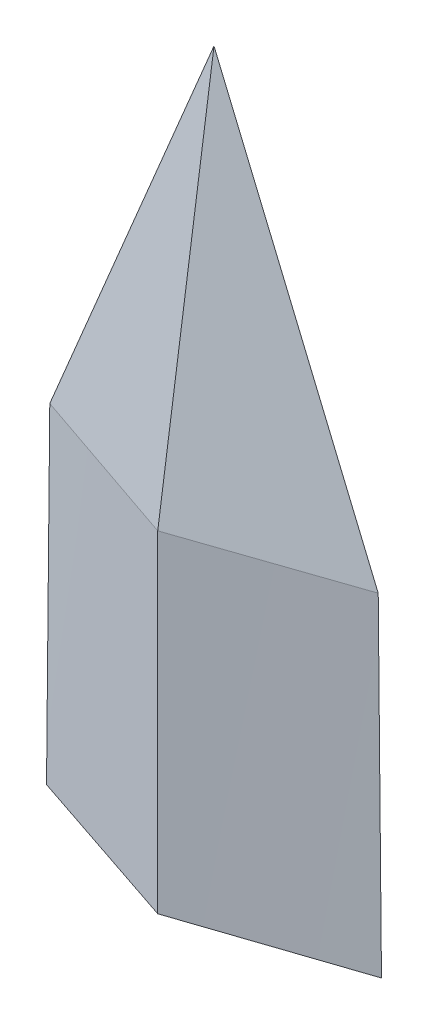
from build123d import *

# Parameters (mm, degrees)
BOSS_EXTRUDE1_DEPTH      = 11.1125
BOSS_EXTRUDE1_DEPTH_BACK = 11.1125
SKETCH5_W                = 109.877468776
SKETCH5_H                = 283.051122129
CUT_EXTRUDE2_DEPTH       = 1193.492852366
SKETCH6_W                = 149.121482991
SKETCH6_H                = 108.921761737
CUT_EXTRUDE3_DEPTH       = 1175.662940665
SKETCH7_R                = 4.7625
CUT_EXTRUDE4_DEPTH       = 635
CUT_EXTRUDE8_DEPTH       = 1195.766301895
CUT_EXTRUDE8_DEPTH_BACK  = 1195.766301895
SKETCH8_W                = 149.774750394
SKETCH8_H                = 148.832770831
SKETCH8_H_2              = 142.875
SKETCH17_R               = 1.5875
CUT_EXTRUDE15_DEPTH      = 12.7


with BuildPart() as part:
    # Sketch1 → Boss-Extrude1 (new, two sides: drawn at the far end of the back side and taken through both)
    with BuildSketch(Plane.XY.offset(-BOSS_EXTRUDE1_DEPTH_BACK)):
        Polygon((142.42123069, 465.168027231), (219.716026672, 465.168027231), (213.502471629, 1096.967634552), (181.068628681, 1174.337215652), (148.634785732, 1096.967634552), align=None)
    extrude(amount=BOSS_EXTRUDE1_DEPTH + BOSS_EXTRUDE1_DEPTH_BACK)

    # Sketch2 → Cut-Loft1 section 0
    with BuildSketch(Plane.XZ.offset(-465.168027231)):
        with BuildLine():
            Line((142.42123069, 0), (181.068628681, 11.1125))
            Line((181.068628681, 11.1125), (219.716026672, 0))
            Line((219.716026672, 0), (222.70513775, 0))
            Line((222.70513775, 0), (222.70513775, 15.258366339))
            Line((222.70513775, 15.258366339), (137.848628215, 15.258366339))
            Line((137.848628215, 15.258366339), (137.848628215, 0))
            Line((137.848628215, 0), (142.42123069, 0))
        make_face()
    # Sketch3 → Cut-Loft1 section 1
    with BuildSketch(Plane(origin=(0, 1096.967634552, 0), x_dir=(1, 0, 0), z_dir=(0, 1, 0))):
        with BuildLine():
            Line((213.502471629, 0), (181.068628681, -11.1125))
            Line((181.068628681, -11.1125), (148.634785732, 0))
            Line((148.634785732, 0), (137.848628215, 0))
            Line((137.848628215, 0), (137.848628215, -15.258366339))
            Line((137.848628215, -15.258366339), (222.70513775, -15.258366339))
            Line((222.70513775, -15.258366339), (222.70513775, 0))
            Line((222.70513775, 0), (213.502471629, 0))
        make_face()
    cut_loft1 = loft(mode=Mode.SUBTRACT)

    # Mirror1: Cut-Loft1 across plane
    add(cut_loft1.mirror(Plane.XY), mode=Mode.SUBTRACT)

    # Sketch5 → Cut-Extrude2 (cut, through all)
    with BuildSketch(Plane(origin=(-32.103098407, 13.457832356, 93.698704331), x_dir=(0.9470206004067627, 0.045661094409327196, 0.31791043842968925), z_dir=(-0.3211728232668741, 0.1346377834927197, 0.937401026696127))):
        with Locations((219.349244299, 1139.303724701)):
            Rectangle(SKETCH5_W, SKETCH5_H)
    cut_extrude2 = extrude(amount=CUT_EXTRUDE2_DEPTH, mode=Mode.SUBTRACT)

    # Sketch6 → Cut-Extrude3 (cut, through all)
    with BuildSketch(Plane(origin=(69.458274406, 29.117370568, 202.726547902), x_dir=(0.9470206004067623, -0.045661094409327495, -0.31791043842969063), z_dir=(0.3211728232668754, 0.13463778349272, 0.9374010266961263))):
        with Locations((131.752816965, 1118.922251835)):
            Rectangle(SKETCH6_W, SKETCH6_H)
    cut_extrude3 = extrude(amount=CUT_EXTRUDE3_DEPTH, mode=Mode.SUBTRACT)

    # Mirror2: Cut-Extrude2, Cut-Extrude3 across plane
    add(cut_extrude2.mirror(Plane.XY), mode=Mode.SUBTRACT)
    add(cut_extrude3.mirror(Plane.XY), mode=Mode.SUBTRACT)

    # Sketch7 → Cut-Extrude4 (cut)
    with BuildSketch(Plane.XZ.offset(-465.168027231)):
        with Locations(Location((181.068628681, 0, 0), (0, 0, 270))):
            Circle(SKETCH7_R)
    extrude(amount=-CUT_EXTRUDE4_DEPTH, mode=Mode.SUBTRACT)

    # Sketch8 → Cut-Extrude8 (cut, two sides: drawn at the far end of the back side and taken through both)
    with BuildSketch(Plane.XY.offset(-CUT_EXTRUDE8_DEPTH_BACK)):
        with Locations((180.5976389, 528.420830237)):
            Rectangle(SKETCH8_W, SKETCH8_H)
        with Locations((180.5976389, 674.274715652)):
            Rectangle(SKETCH8_W, SKETCH8_H_2)
        with Locations((180.5976389, 817.149715652)):
            Rectangle(SKETCH8_W, SKETCH8_H_2)
        with Locations((180.5976389, 960.024715652)):
            Rectangle(SKETCH8_W, SKETCH8_H_2)
    extrude(amount=CUT_EXTRUDE8_DEPTH + CUT_EXTRUDE8_DEPTH_BACK, mode=Mode.SUBTRACT)

    # Sketch17 → Cut-Extrude15 (cut)
    with BuildSketch(Plane.XZ.offset(-1031.462215652)):
        with Locations(Location((168.368628681, 0, 0), (0, 0, 270))):
            Circle(SKETCH17_R)
        with Locations(Location((193.768628681, 0, 0), (0, 0, 270))):
            Circle(SKETCH17_R)
    extrude(amount=-CUT_EXTRUDE15_DEPTH, mode=Mode.SUBTRACT)


solid = part.part
